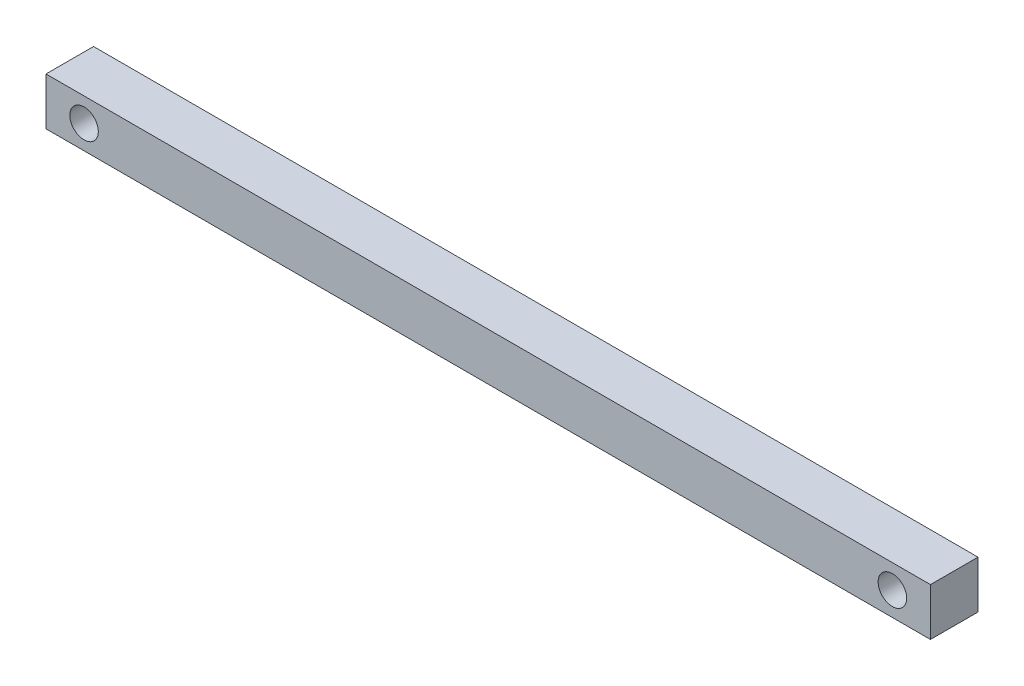
from build123d import *

# Parameters (mm, degrees)
SKETCH1_W           = 465
SKETCH1_H           = 25
SKETCH1_R           = 7.5
BOSS_EXTRUDE1_DEPTH = 25


with BuildPart() as part:
    # Sketch1 → Boss-Extrude1 (new body)
    with BuildSketch(Plane.XY):
        Rectangle(SKETCH1_W, SKETCH1_H)
        with Locations((-212.5, 0)):
            Circle(SKETCH1_R, mode=Mode.SUBTRACT)
        with Locations((212.5, 0)):
            Circle(SKETCH1_R, mode=Mode.SUBTRACT)
    extrude(amount=BOSS_EXTRUDE1_DEPTH)


solid = part.part
